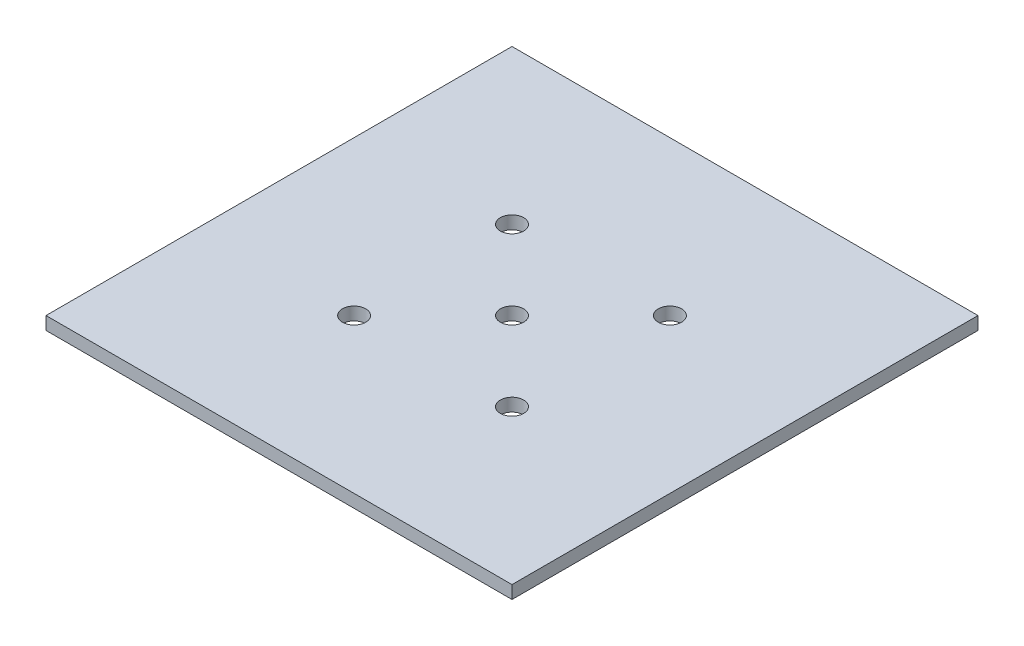
from build123d import *

# Parameters (mm, degrees)
SKETCH1_W                = 90
SKETCH1_H                = 90
BOSS_EXTRUDE1_DEPTH      = 1.25
M4_CLEARANCE_HOLE1_D     = 4.5
M4_CLEARANCE_HOLE1_DEPTH = 5.2
M4_CLEARANCE_HOLE1_TIP   = 1.351936393


with BuildPart() as part:
    # Sketch1 → Boss-Extrude1 (new, symmetric)
    with BuildSketch(Plane(origin=(0, 0, 0), x_dir=(1, 0, 0), z_dir=(0, 1, 0))):
        Rectangle(SKETCH1_W, SKETCH1_H)
    extrude(amount=BOSS_EXTRUDE1_DEPTH, both=True)

    # M4 Clearance Hole1
    with Locations(Plane(origin=(0, 1.25, 0), x_dir=(1, 0, 0), z_dir=(0, 1, 0))):
        with Locations((0, 0), (15.25, 15.25), (-15.25, -15.25), (-15.25, 15.25), (15.25, -15.25)):
            Hole(M4_CLEARANCE_HOLE1_D / 2, depth=M4_CLEARANCE_HOLE1_DEPTH)
            with Locations((0, 0, -(M4_CLEARANCE_HOLE1_DEPTH + M4_CLEARANCE_HOLE1_TIP / 2))):  # 118° drill point
                Cone(0, M4_CLEARANCE_HOLE1_D / 2, M4_CLEARANCE_HOLE1_TIP, mode=Mode.SUBTRACT)


solid = part.part
